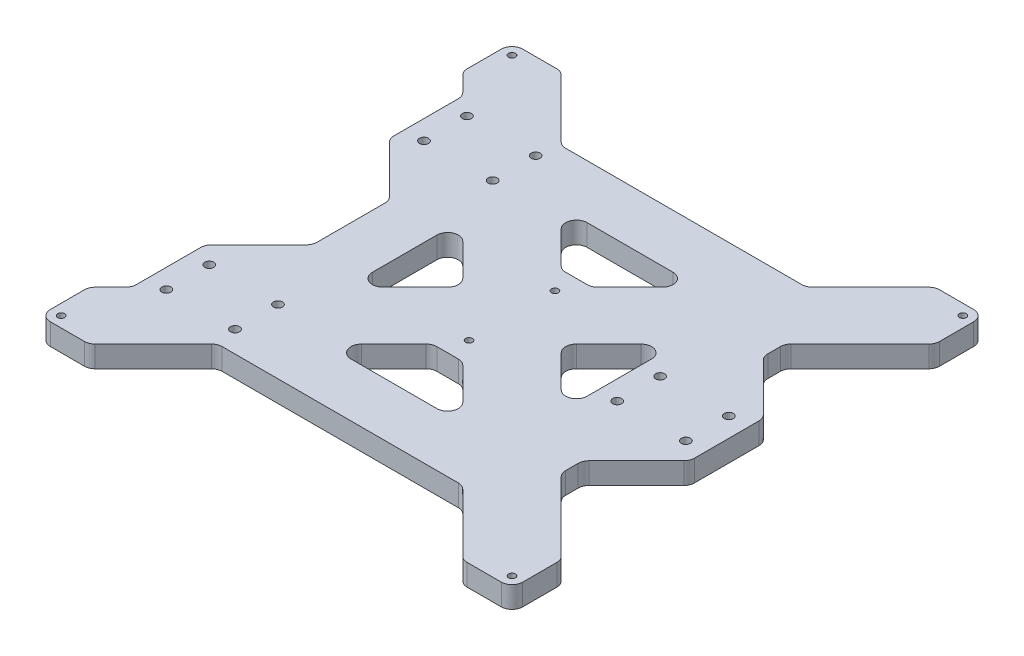
from build123d import *

# Parameters (mm, degrees)
SKETCH_1_R      = 1.6
SKETCH_1_R_2    = 2.1
EXTRUDE_1_DEPTH = 10


with BuildPart() as part:
    # Эскиз1 → Бобышка-Вытянуть1 (new body)
    with BuildSketch(Plane(origin=(0, 0, 0), x_dir=(1, 0, 0), z_dir=(0, 1, 0))):
        with BuildLine():
            Line((-105, 110), (-89.142135624, 110))
            ThreePointArc((-89.142135624, 110), (-87.228718462, 109.619397663), (-85.606601718, 108.535533906))
            Line((-85.606601718, 108.535533906), (-58.535533906, 81.464466094))
            ThreePointArc((-58.535533906, 81.464466094), (-56.913417162, 80.380602337), (-55, 80))
            Line((-55, 80), (55, 80))
            ThreePointArc((55, 80), (56.913417162, 80.380602337), (58.535533906, 81.464466094))
            Line((58.535533906, 81.464466094), (85.606601718, 108.535533906))
            ThreePointArc((85.606601718, 108.535533906), (87.228718462, 109.619397663), (89.142135624, 110))
            Line((89.142135624, 110), (105, 110))
            ThreePointArc((105, 110), (108.535533906, 108.535533906), (110, 105))
            Line((110, 105), (110, 89.142135624))
            ThreePointArc((110, 89.142135624), (109.619397663, 87.228718462), (108.535533906, 85.606601718))
            Line((108.535533906, 85.606601718), (76.464466094, 53.535533906))
            ThreePointArc((76.464466094, 53.535533906), (75.380602337, 51.913417162), (75, 50))
            Line((75, 50), (75, 44.142135624))
            ThreePointArc((75, 44.142135624), (75.380602337, 42.228718462), (76.464466094, 40.606601718))
            Line((76.464466094, 40.606601718), (98.535533906, 18.535533906))
            ThreePointArc((98.535533906, 18.535533906), (99.619397663, 16.913417162), (100, 15))
            Line((100, 15), (100, -15))
            ThreePointArc((100, -15), (99.619397663, -16.913417162), (98.535533906, -18.535533906))
            Line((98.535533906, -18.535533906), (76.464466094, -40.606601718))
            ThreePointArc((76.464466094, -40.606601718), (75.380602337, -42.228718462), (75, -44.142135624))
            Line((75, -44.142135624), (75, -50))
            ThreePointArc((75, -50), (75.380602337, -51.913417162), (76.464466094, -53.535533906))
            Line((76.464466094, -53.535533906), (108.535533906, -85.606601718))
            ThreePointArc((108.535533906, -85.606601718), (109.619397663, -87.228718462), (110, -89.142135624))
            Line((110, -89.142135624), (110, -105))
            ThreePointArc((110, -105), (108.535533906, -108.535533906), (105, -110))
            Line((105, -110), (89.142135624, -110))
            ThreePointArc((89.142135624, -110), (87.228718462, -109.619397663), (85.606601718, -108.535533906))
            Line((85.606601718, -108.535533906), (58.535533906, -81.464466094))
            ThreePointArc((58.535533906, -81.464466094), (56.913417162, -80.380602337), (55, -80))
            Line((55, -80), (-55, -80))
            ThreePointArc((-55, -80), (-56.913417162, -80.380602337), (-58.535533906, -81.464466094))
            Line((-58.535533906, -81.464466094), (-85.606601718, -108.535533906))
            ThreePointArc((-85.606601718, -108.535533906), (-87.228718462, -109.619397663), (-89.142135624, -110))
            Line((-89.142135624, -110), (-105, -110))
            ThreePointArc((-105, -110), (-108.535533906, -108.535533906), (-110, -105))
            Line((-110, -105), (-110, -89.142135624))
            ThreePointArc((-110, -89.142135624), (-109.619397663, -87.228718462), (-108.535533906, -85.606601718))
            Line((-108.535533906, -85.606601718), (-101.464466094, -78.535533906))
            ThreePointArc((-101.464466094, -78.535533906), (-100.380602337, -76.913417162), (-100, -75))
            Line((-100, -75), (-100, -45))
            ThreePointArc((-100, -45), (-99.619397663, -43.086582838), (-98.535533906, -41.464466094))
            Line((-98.535533906, -41.464466094), (-76.464466094, -19.393398282))
            ThreePointArc((-76.464466094, -19.393398282), (-75.380602337, -17.771281538), (-75, -15.857864376))
            Line((-75, -15.857864376), (-75, 15.857864376))
            ThreePointArc((-75, 15.857864376), (-75.380602337, 17.771281538), (-76.464466094, 19.393398282))
            Line((-76.464466094, 19.393398282), (-98.535533906, 41.464466094))
            ThreePointArc((-98.535533906, 41.464466094), (-99.619397663, 43.086582838), (-100, 45))
            Line((-100, 45), (-100, 75))
            ThreePointArc((-100, 75), (-100.380602337, 76.913417162), (-101.464466094, 78.535533906))
            Line((-101.464466094, 78.535533906), (-108.535533906, 85.606601718))
            ThreePointArc((-108.535533906, 85.606601718), (-109.619397663, 87.228718462), (-110, 89.142135624))
            Line((-110, 89.142135624), (-110, 105))
            ThreePointArc((-110, 105), (-108.535533906, 108.535533906), (-105, 110))
        make_face()
        with Locations(Location((105, 105, 0), (0, 0, 270))):
            Circle(SKETCH_1_R, mode=Mode.SUBTRACT)
        with Locations(Location((105, -105, 0), (0, 0, 270))):
            Circle(SKETCH_1_R, mode=Mode.SUBTRACT)
        with Locations(Location((-105, -105, 0), (0, 0, 270))):
            Circle(SKETCH_1_R, mode=Mode.SUBTRACT)
        with Locations(Location((-105, 105, 0), (0, 0, 270))):
            Circle(SKETCH_1_R, mode=Mode.SUBTRACT)
        with Locations(Location((-91, 70, 0), (0, 0, 270))):
            Circle(SKETCH_1_R_2, mode=Mode.SUBTRACT)
        with Locations(Location((-59, 70, 0), (0, 0, 270))):
            Circle(SKETCH_1_R_2, mode=Mode.SUBTRACT)
        with Locations(Location((-59, 50, 0), (0, 0, 270))):
            Circle(SKETCH_1_R_2, mode=Mode.SUBTRACT)
        with Locations(Location((-91, 50, 0), (0, 0, 270))):
            Circle(SKETCH_1_R_2, mode=Mode.SUBTRACT)
        with Locations(Location((-59, -50, 0), (0, 0, 270))):
            Circle(SKETCH_1_R_2, mode=Mode.SUBTRACT)
        with Locations(Location((-91, -50, 0), (0, 0, 270))):
            Circle(SKETCH_1_R_2, mode=Mode.SUBTRACT)
        with Locations(Location((-91, -70, 0), (0, 0, 270))):
            Circle(SKETCH_1_R_2, mode=Mode.SUBTRACT)
        with Locations(Location((-59, -70, 0), (0, 0, 270))):
            Circle(SKETCH_1_R_2, mode=Mode.SUBTRACT)
        with Locations(Location((91, -10, 0), (0, 0, 270))):
            Circle(SKETCH_1_R_2, mode=Mode.SUBTRACT)
        with Locations(Location((59, -10, 0), (0, 0, 270))):
            Circle(SKETCH_1_R_2, mode=Mode.SUBTRACT)
        with Locations(Location((59, 10, 0), (0, 0, 270))):
            Circle(SKETCH_1_R_2, mode=Mode.SUBTRACT)
        with Locations(Location((91, 10, 0), (0, 0, 270))):
            Circle(SKETCH_1_R_2, mode=Mode.SUBTRACT)
        with Locations(Location((0, -20, 0), (0, 0, 270))):
            Circle(SKETCH_1_R, mode=Mode.SUBTRACT)
        with Locations(Location((0, 20, 0), (0, 0, 270))):
            Circle(SKETCH_1_R, mode=Mode.SUBTRACT)
        with BuildLine():
            Line((-23.535533906, -46.464466094), (-8.535533906, -31.464466094))
            ThreePointArc((-8.535533906, -31.464466094), (-6.913417162, -30.380602337), (-5, -30))
            Line((-5, -30), (5, -30))
            ThreePointArc((5, -30), (6.913417162, -30.380602337), (8.535533906, -31.464466094))
            Line((8.535533906, -31.464466094), (23.535533906, -46.464466094))
            ThreePointArc((23.535533906, -46.464466094), (24.619397663, -51.913417162), (20, -55))
            Line((20, -55), (-20, -55))
            ThreePointArc((-20, -55), (-24.619397663, -51.913417162), (-23.535533906, -46.464466094))
        make_face(mode=Mode.SUBTRACT)
        with BuildLine():
            Line((23.535533906, 46.464466094), (8.535533906, 31.464466094))
            ThreePointArc((8.535533906, 31.464466094), (6.913417162, 30.380602337), (5, 30))
            Line((5, 30), (-5, 30))
            ThreePointArc((-5, 30), (-6.913417162, 30.380602337), (-8.535533906, 31.464466094))
            Line((-8.535533906, 31.464466094), (-23.535533906, 46.464466094))
            ThreePointArc((-23.535533906, 46.464466094), (-24.619397663, 51.913417162), (-20, 55))
            Line((-20, 55), (20, 55))
            ThreePointArc((20, 55), (24.619397663, 51.913417162), (23.535533906, 46.464466094))
        make_face(mode=Mode.SUBTRACT)
        with BuildLine():
            Line((-50, 15), (-50, -15))
            ThreePointArc((-50, -15), (-46.913417162, -19.619397663), (-41.464466094, -18.535533906))
            Line((-41.464466094, -18.535533906), (-26.464466094, -3.535533906))
            ThreePointArc((-26.464466094, -3.535533906), (-25, 0), (-26.464466094, 3.535533906))
            Line((-26.464466094, 3.535533906), (-41.464466094, 18.535533906))
            ThreePointArc((-41.464466094, 18.535533906), (-46.913417162, 19.619397663), (-50, 15))
        make_face(mode=Mode.SUBTRACT)
        with BuildLine():
            Line((41.464466094, 18.535533906), (26.464466094, 3.535533906))
            ThreePointArc((26.464466094, 3.535533906), (25, 0), (26.464466094, -3.535533906))
            Line((26.464466094, -3.535533906), (41.464466094, -18.535533906))
            ThreePointArc((41.464466094, -18.535533906), (46.913417162, -19.619397663), (50, -15))
            Line((50, -15), (50, 15))
            ThreePointArc((50, 15), (46.913417162, 19.619397663), (41.464466094, 18.535533906))
        make_face(mode=Mode.SUBTRACT)
    extrude(amount=EXTRUDE_1_DEPTH)


solid = part.part
